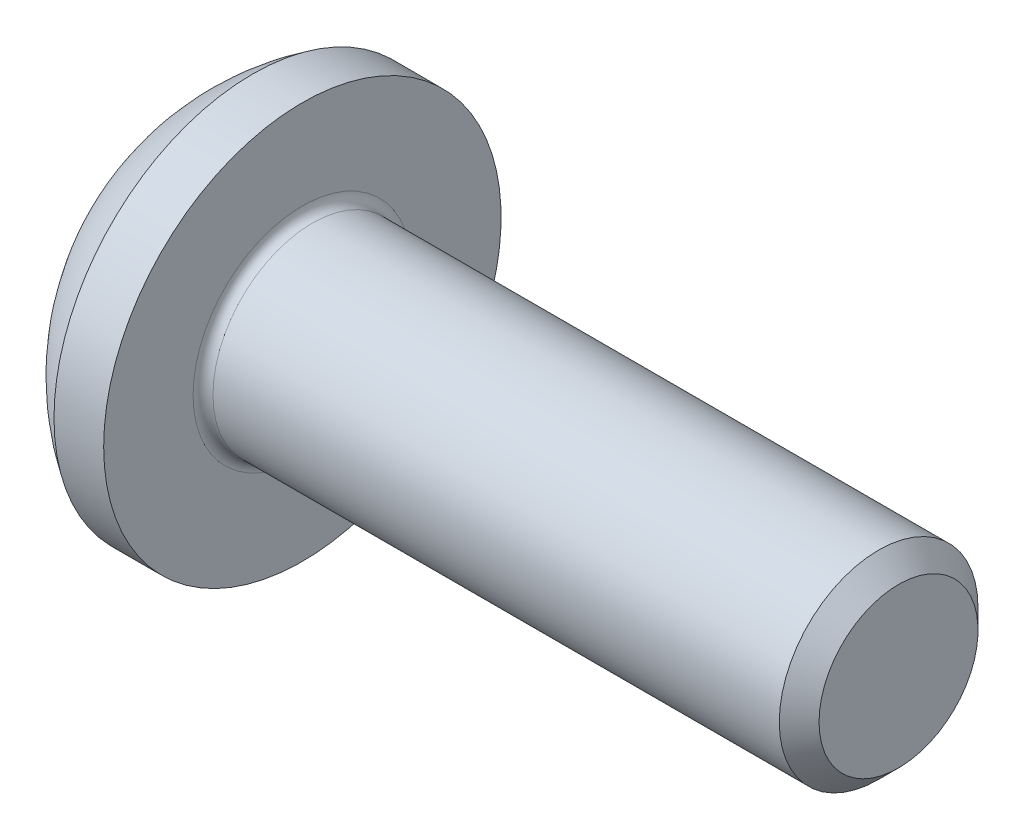
from build123d import *

# Parameters (mm, degrees)
CHAMFER_1_SIZE = 0.2


with BuildPart() as part:
    # 草图2 → Revolve 539 (revolve)
    with BuildSketch(Plane.XY):
        with BuildLine():
            Line((0, 0), (7.6, 0))
            Line((7.6, 0), (7.6, 1))
            Line((7.6, 1), (1.7, 1))
            ThreePointArc((1.7, 1), (1.629289322, 1.029289322), (1.6, 1.1))
            Line((1.6, 1.1), (1.6, 2))
            Line((1.6, 2), (1.1, 2))
            ThreePointArc((1.1, 2), (0.293143234, 1.141271221), (0, 0))
        make_face()
    revolve(axis=Axis((-1.331757704, 0, 0), (1, 0, 0)))

    # 草图5 → 切除-放样1 section 0
    with BuildSketch(Plane(origin=(0, 0, 0), x_dir=(0, 0, -1), z_dir=(1, 0, 0)), mode=Mode.PRIVATE) as loft_1_s0:
        with BuildLine():
            Line((0.25, 0.95), (-0.25, 0.95))
            Line((-0.25, 0.95), (-0.25, -0.95))
            Line((-0.25, -0.95), (0.25, -0.95))
            Line((0.25, -0.95), (0.25, 0.95))
        make_face()
    loft_1 = loft([Vertex(1.2, 0, 0), loft_1_s0.sketch], mode=Mode.SUBTRACT)

    # 镜向1: 切除-放样1 across plane
    add(loft_1.mirror(Plane(origin=(0, 0, 0), x_dir=(0, 0.7071067811865462, 0.7071067811865488), z_dir=(0, -0.7071067811865488, 0.7071067811865462))), mode=Mode.SUBTRACT)

    # 倒角1
    chamfer_1_edges = [part.edges().sort_by_distance(p)[0] for p in [
        (7.6, -1, 0),
    ]]
    chamfer(chamfer_1_edges, length=CHAMFER_1_SIZE)


solid = part.part
